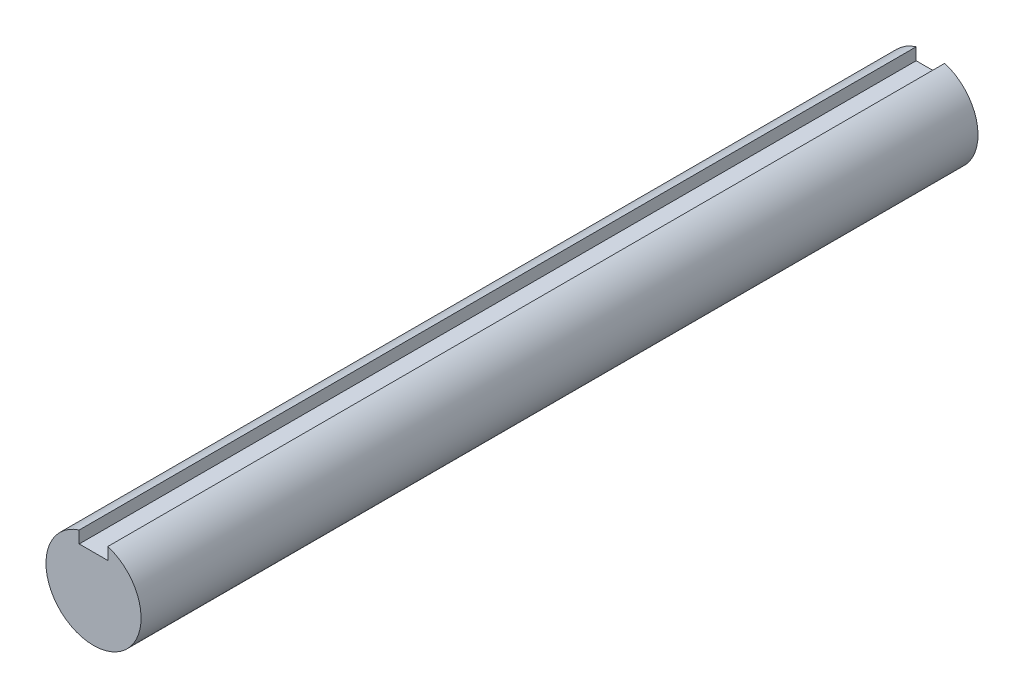
from build123d import *

# Parameters (mm, degrees)
BOSS_EXTRUDE1_DEPTH      = 34.925
BOSS_EXTRUDE1_DEPTH_BACK = 34.925


with BuildPart() as part:
    # Sketch3 → Boss-Extrude1 (new, two sides: drawn at the far end of the back side and taken through both)
    with BuildSketch(Plane.XY.offset(-BOSS_EXTRUDE1_DEPTH_BACK)):
        with BuildLine():
            Line((-1.1938, 2.77495), (-1.1938, 3.784946251))
            ThreePointArc((-1.1938, 3.784946251), (0, -3.96875), (1.1938, 3.784946251))
            Line((1.1938, 3.784946251), (1.1938, 2.77495))
            Line((1.1938, 2.77495), (-1.1938, 2.77495))
        make_face()
    extrude(amount=BOSS_EXTRUDE1_DEPTH + BOSS_EXTRUDE1_DEPTH_BACK)


solid = part.part
